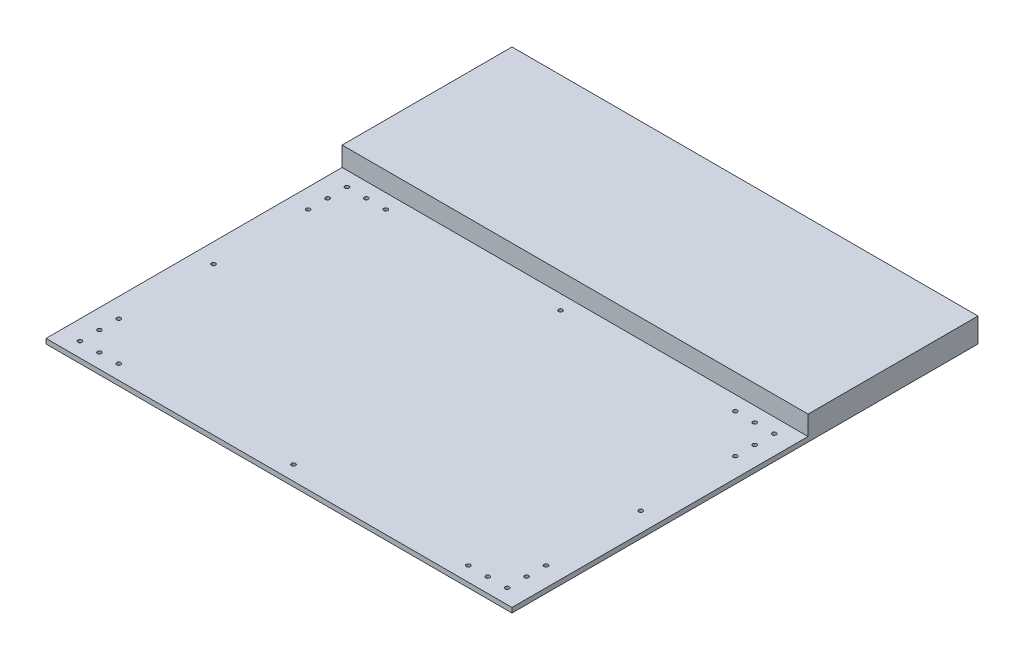
from build123d import *

# Parameters (mm, degrees)
SKETCH1_W                  = 609.6
SKETCH1_H                  = 609.6
BOSS_EXTRUDE1_DEPTH        = 6.35
SKETCH2_W                  = 609.6
SKETCH2_H                  = 222.25
BOSS_EXTRUDE2_DEPTH        = 25.4
F_5_3_5_3_DIAMETER_HOLE1_D = 5.3


with BuildPart() as part:
    # Sketch1 → Boss-Extrude1 (new body)
    with BuildSketch(Plane(origin=(0, 0, 0), x_dir=(1, 0, 0), z_dir=(0, 1, 0))):
        with Locations((304.8, 304.8)):
            Rectangle(SKETCH1_W, SKETCH1_H)
    extrude(amount=BOSS_EXTRUDE1_DEPTH)

    # Sketch2 → Boss-Extrude2 (add)
    with BuildSketch(Plane(origin=(0, 6.35, 0), x_dir=(1, 0, 0), z_dir=(0, 1, 0))):
        with Locations((304.8, 498.475)):
            Rectangle(SKETCH2_W, SKETCH2_H)
    extrude(amount=BOSS_EXTRUDE2_DEPTH)

    # Ø5.3 (5.3) Diameter Hole1 (through all)
    with Locations(Plane(origin=(0, 6.35, 0), x_dir=(1, 0, 0), z_dir=(0, 1, 0))):
        with Locations((25.4, 368.3), (50.8, 368.3), (76.2, 368.3), (25.4, 342.9), (25.4, 317.5), (25.4, 69.85), (25.4, 44.45), (25.4, 19.05), (50.8, 19.05), (76.2, 19.05), (304.8, 19.05), (25.4, 193.675), (304.8, 368.3), (584.2, 193.675), (533.4, 368.3), (558.8, 368.3), (584.2, 368.3), (584.2, 342.9), (584.2, 317.5), (584.2, 69.85), (584.2, 44.45), (584.2, 19.05), (558.8, 19.05), (533.4, 19.05)):
            Hole(F_5_3_5_3_DIAMETER_HOLE1_D / 2)


solid = part.part
